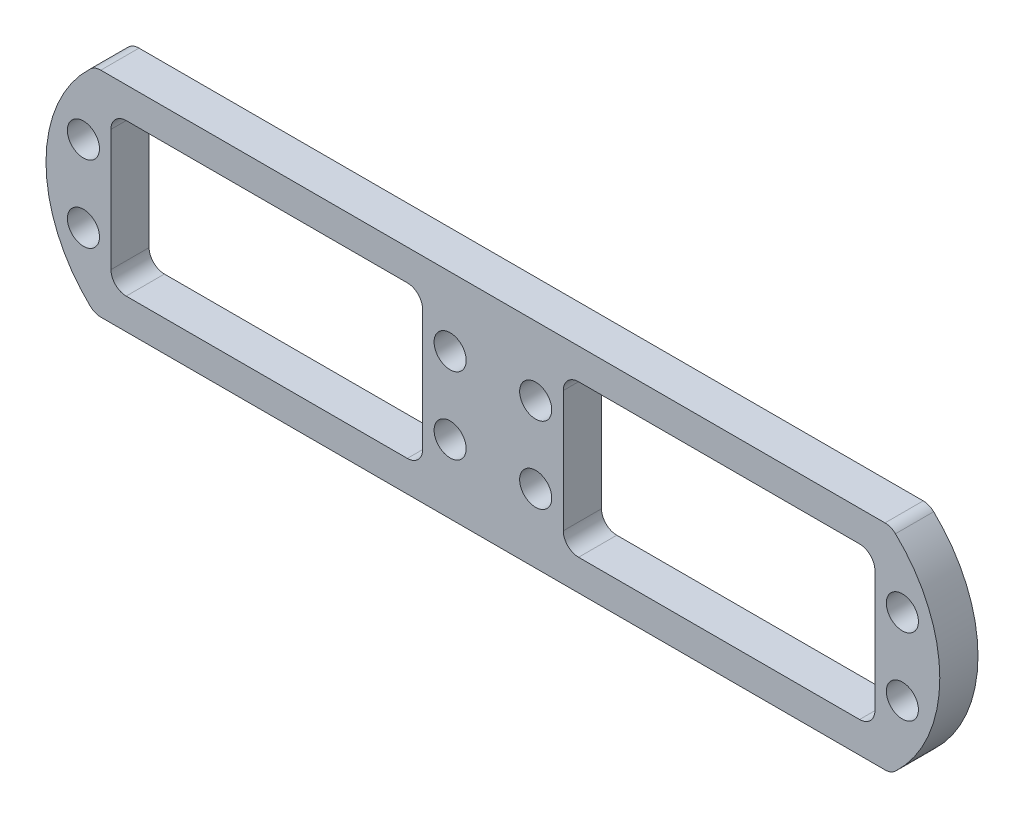
from build123d import *

# Parameters (mm, degrees)
EXTRUSION1_DEPTH        = 5
ESQUISSE2_R             = 2.1
ENL_V_MAT_EXTRU_1_DEPTH = 100.61551084


with BuildPart() as part:
    # Esquisse1 → Extrusion1 (new body)
    with BuildSketch(Plane.XY):
        with BuildLine():
            Line((-11.324751653, 14), (91.324751653, 14))
            ThreePointArc((91.324751653, 14), (92.063300599, 13.858640755), (92.697448823, 13.454545455))
            ThreePointArc((92.697448823, 13.454545455), (98.5, 0), (92.697448823, -13.454545455))
            ThreePointArc((92.697448823, -13.454545455), (92.063300599, -13.858640755), (91.324751653, -14))
            Line((91.324751653, -14), (-11.324751653, -14))
            ThreePointArc((-11.324751653, -14), (-12.063300599, -13.858640755), (-12.697448823, -13.454545455))
            ThreePointArc((-12.697448823, -13.454545455), (-18.5, 0), (-12.697448823, 13.454545455))
            ThreePointArc((-12.697448823, 13.454545455), (-12.063300599, 13.858640755), (-11.324751653, 14))
        make_face()
        with BuildLine():
            Line((51.215395011, 9.95), (88, 9.95))
            ThreePointArc((88, 9.95), (89.414213562, 9.364213562), (90, 7.95))
            Line((90, 7.95), (90, -7.95))
            ThreePointArc((90, -7.95), (89.414213562, -9.364213562), (88, -9.95))
            Line((88, -9.95), (51.215395011, -9.95))
            ThreePointArc((51.215395011, -9.95), (49.801181448, -9.364213562), (49.215395011, -7.95))
            Line((49.215395011, -7.95), (49.215395011, 7.95))
            ThreePointArc((49.215395011, 7.95), (49.801181448, 9.364213562), (51.215395011, 9.95))
        make_face(mode=Mode.SUBTRACT)
        with BuildLine():
            Line((-8, 9.95), (28.8, 9.95))
            ThreePointArc((28.8, 9.95), (30.214213562, 9.364213562), (30.8, 7.95))
            Line((30.8, 7.95), (30.8, -7.95))
            ThreePointArc((30.8, -7.95), (30.214213562, -9.364213562), (28.8, -9.95))
            Line((28.8, -9.95), (-8, -9.95))
            ThreePointArc((-8, -9.95), (-9.414213562, -9.364213562), (-10, -7.95))
            Line((-10, -7.95), (-10, 7.95))
            ThreePointArc((-10, 7.95), (-9.414213562, 9.364213562), (-8, 9.95))
        make_face(mode=Mode.SUBTRACT)
    extrude(amount=EXTRUSION1_DEPTH)

    # Esquisse2 → Enlèv. mat.-Extru.1 (cut, through all)
    with BuildSketch(Plane.XY):
        with Locations((-13.6, 5)):
            Circle(ESQUISSE2_R)
        with Locations((45.6, -5)):
            Circle(ESQUISSE2_R)
        with Locations((34.4, 5)):
            Circle(ESQUISSE2_R)
        with Locations((-13.6, -5)):
            Circle(ESQUISSE2_R)
        with Locations((93.6, 5)):
            Circle(ESQUISSE2_R)
        with Locations((93.6, -5)):
            Circle(ESQUISSE2_R)
        with Locations((45.6, 5)):
            Circle(ESQUISSE2_R)
        with Locations((34.4, -5)):
            Circle(ESQUISSE2_R)
    extrude(amount=ENL_V_MAT_EXTRU_1_DEPTH, mode=Mode.SUBTRACT)


solid = part.part
